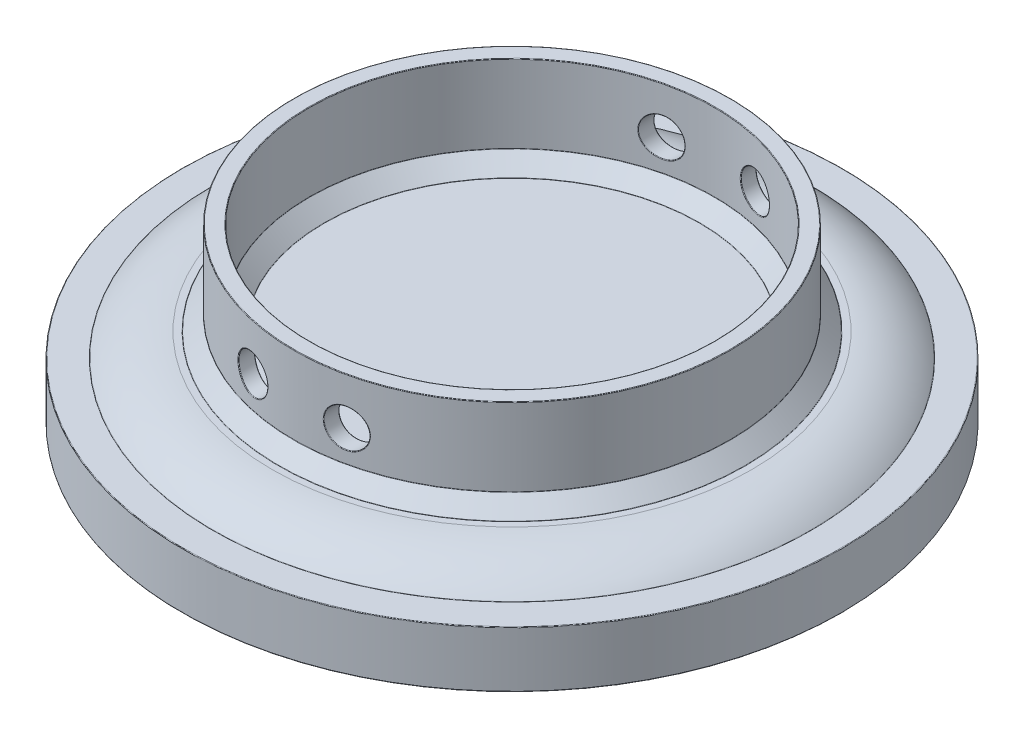
from build123d import *

# Parameters (mm, degrees)
SKETCH1_W               = 8.3
SKETCH1_H               = 41.6
CUT_EXTRUDE1_DEPTH      = 266.36013265
CUT_EXTRUDE1_DEPTH_BACK = 266.36013265
SKETCH2_R               = 10
FILLET1_R               = 0.3


with BuildPart() as part:
    # Sketch1 → Revolve1 (revolve)
    with BuildSketch(Plane.XY):
        with BuildLine():
            ThreePointArc((128.03, 42.4), (144.942428123, 39.18819863), (159.5, 30))
            Line((159.5, 30), (176, 30))
            Line((176, 30), (176, 0))
            Line((176, 0), (172, 0))
            Line((172, 0), (151.885277943, 20.117763819))
            ThreePointArc((151.885277943, 20.117763819), (140.940585557, 27.431671182), (128.03, 30))
            Line((128.03, 30), (0, 30))
            Line((0, 30), (0, 42.4))
            Line((0, 42.4), (128.03, 42.4))
        make_face()
        Polygon((108.2, 50.4), (100.2, 42.4), (124.5, 42.4), (116.5, 50.4), align=None)
        with Locations((112.35, 71.2)):
            Rectangle(SKETCH1_W, SKETCH1_H)
    revolve(axis=Axis((0, 0, 0), (0, 1, 0)))

    # Sketch2 → Cut-Extrude1 (cut, two sides: drawn at the far end of the back side and taken through both)
    with BuildSketch(Plane.XY.offset(-CUT_EXTRUDE1_DEPTH_BACK)):
        with Locations((25, 67)):
            Circle(SKETCH2_R)
        with Locations((-25, 67)):
            Circle(SKETCH2_R)
    extrude(amount=CUT_EXTRUDE1_DEPTH + CUT_EXTRUDE1_DEPTH_BACK, mode=Mode.SUBTRACT)

    # Fillet1
    fillet1_edges = [part.edges().sort_by_distance(p)[0] for p in [
        (-159.5, 30, 0),
        (-176, 30, 0),
        (-176, 0, 0),
        (-172, 0, 0),
        (-100.2, 42.4, 0),
        (-108.2, 50.4, 0),
        (-108.2, 92, 0),
        (-116.5, 92, 0),
        (-116.5, 50.4, 0),
        (-124.5, 42.4, 0),
        (-35, 67, -111.118180331),
        (-35, 67, 111.118180331),
        (-35, 67, 102.382811058),
        (-35, 67, -102.382811058),
        (15, 67, -115.530299056),
        (15, 67, 115.530299056),
        (15, 67, 107.155214525),
        (15, 67, -107.155214525),
    ]]
    fillet(fillet1_edges, radius=FILLET1_R)


solid = part.part
